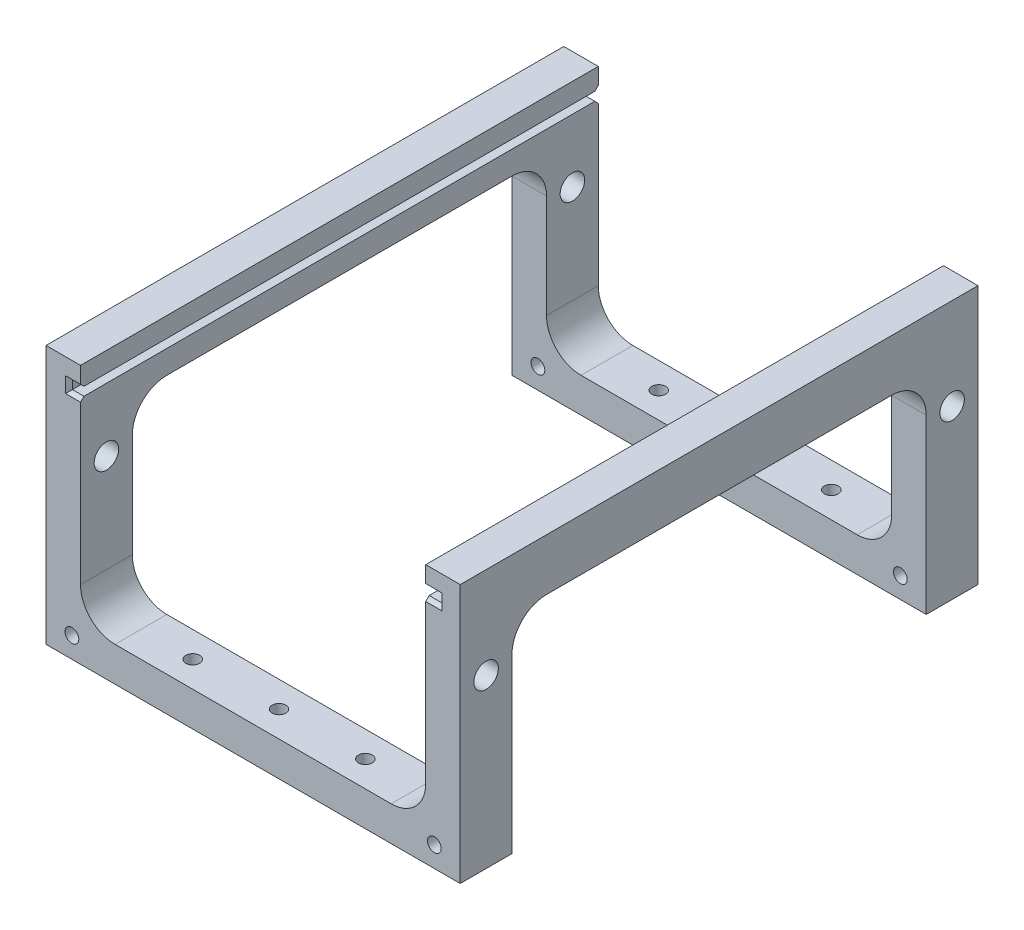
from build123d import *

# Parameters (mm, degrees)
SKETCH1_W           = 120
SKETCH1_H           = 150
BOSS_EXTRUDE1_DEPTH = 75
SKETCH3_W           = 107
SKETCH3_H           = 2.5
CUT_EXTRUDE2_DEPTH  = 179.115131306
SKETCH2_W           = 100
SKETCH2_H           = 150
CUT_EXTRUDE1_DEPTH  = 65
FILLET1_R           = 10
SKETCH4_R           = 2
CUT_EXTRUDE3_DEPTH  = 116.974135047
SKETCH5_R           = 2
CUT_EXTRUDE4_DEPTH  = 179.115131306
SKETCH6_R           = 3.55
CUT_EXTRUDE5_DEPTH  = 161.15617378
CHAMFER1_SIZE       = 1
SKETCH7_W           = 120
SKETCH7_H           = 60
CUT_EXTRUDE6_DEPTH  = 161.15617378
FILLET2_R           = 10


with BuildPart() as part:
    # Sketch1 → Boss-Extrude1 (new body)
    with BuildSketch(Plane(origin=(0, 0, 0), x_dir=(1, 0, 0), z_dir=(0, 1, 0))):
        Rectangle(SKETCH1_W, SKETCH1_H)
    extrude(amount=BOSS_EXTRUDE1_DEPTH)

    # Sketch3 → Cut-Extrude2 (cut, through all)
    with BuildSketch(Plane.XY.offset(75)):
        with Locations((0.15445013, 68)):
            Rectangle(SKETCH3_W, SKETCH3_H)
    extrude(amount=-CUT_EXTRUDE2_DEPTH, mode=Mode.SUBTRACT)

    # Sketch2 → Cut-Extrude1 (cut)
    with BuildSketch(Plane(origin=(0, 75, 0), x_dir=(1, 0, 0), z_dir=(0, 1, 0))):
        Rectangle(SKETCH2_W, SKETCH2_H)
    extrude(amount=-CUT_EXTRUDE1_DEPTH, mode=Mode.SUBTRACT)

    # Fillet1
    fillet1_edges = [part.edges().sort_by_distance(p)[0] for p in [
        (50, 10, 0),
        (-50, 10, 0),
    ]]
    fillet(fillet1_edges, radius=FILLET1_R)

    # Sketch4 → Cut-Extrude3 (cut, through all)
    with BuildSketch(Plane(origin=(0, 10, 0), x_dir=(1, 0, 0), z_dir=(0, 1, 0))):
        with Locations(Location((0, 67.5, 0), (0, 0, 270))):
            Circle(SKETCH4_R)
        with Locations(Location((25, 67.5, 0), (0, 0, 270))):
            Circle(SKETCH4_R)
        with Locations(Location((-25, 67.5, 0), (0, 0, 270))):
            Circle(SKETCH4_R)
        with Locations(Location((-25, -67.5, 0), (0, 0, 90))):
            Circle(SKETCH4_R)
        with Locations(Location((25, -67.5, 0), (0, 0, 90))):
            Circle(SKETCH4_R)
        with Locations(Location((0, -67.5, 0), (0, 0, 90))):
            Circle(SKETCH4_R)
    extrude(amount=-CUT_EXTRUDE3_DEPTH, mode=Mode.SUBTRACT)

    # Sketch5 → Cut-Extrude4 (cut, through all)
    with BuildSketch(Plane.XY.offset(75)):
        with Locations((-52.5, 6)):
            Circle(SKETCH5_R)
        with Locations((52.5, 6)):
            Circle(SKETCH5_R)
    extrude(amount=-CUT_EXTRUDE4_DEPTH, mode=Mode.SUBTRACT)

    # Sketch6 → Cut-Extrude5 (cut, through all)
    with BuildSketch(Plane(origin=(60, 0, 0), x_dir=(0, 0, -1), z_dir=(1, 0, 0))):
        with Locations((67.5, 48.5)):
            Circle(SKETCH6_R)
        with Locations((-67.5, 48.5)):
            Circle(SKETCH6_R)
    extrude(amount=-CUT_EXTRUDE5_DEPTH, mode=Mode.SUBTRACT)

    # Chamfer1
    chamfer1_edges = [part.edges().sort_by_distance(p)[0] for p in [
        (53.65445013, 68, -75),
        (-51.672774935, 66.75, -75),
        (-53.34554987, 68, -75),
        (51.827225065, 69.25, -75),
        (53.65445013, 68, 75),
        (51.827225065, 69.25, 75),
        (-53.34554987, 68, 75),
        (-51.672774935, 66.75, 75),
        (-51.672774935, 69.25, 75),
        (-51.672774935, 69.25, -75),
        (51.827225065, 66.75, 75),
        (51.827225065, 66.75, -75),
    ]]
    chamfer(chamfer1_edges, length=CHAMFER1_SIZE)

    # Sketch7 → Cut-Extrude6 (cut, through all)
    with BuildSketch(Plane(origin=(60, 0, 0), x_dir=(0, 0, -1), z_dir=(1, 0, 0))):
        with Locations((0, 30)):
            Rectangle(SKETCH7_W, SKETCH7_H)
    extrude(amount=-CUT_EXTRUDE6_DEPTH, mode=Mode.SUBTRACT)

    # Fillet2
    fillet2_edges = [part.edges().sort_by_distance(p)[0] for p in [
        (55, 60, 60),
        (-55, 60, 60),
        (-55, 60, -60),
        (55, 60, -60),
    ]]
    fillet(fillet2_edges, radius=FILLET2_R)


solid = part.part
